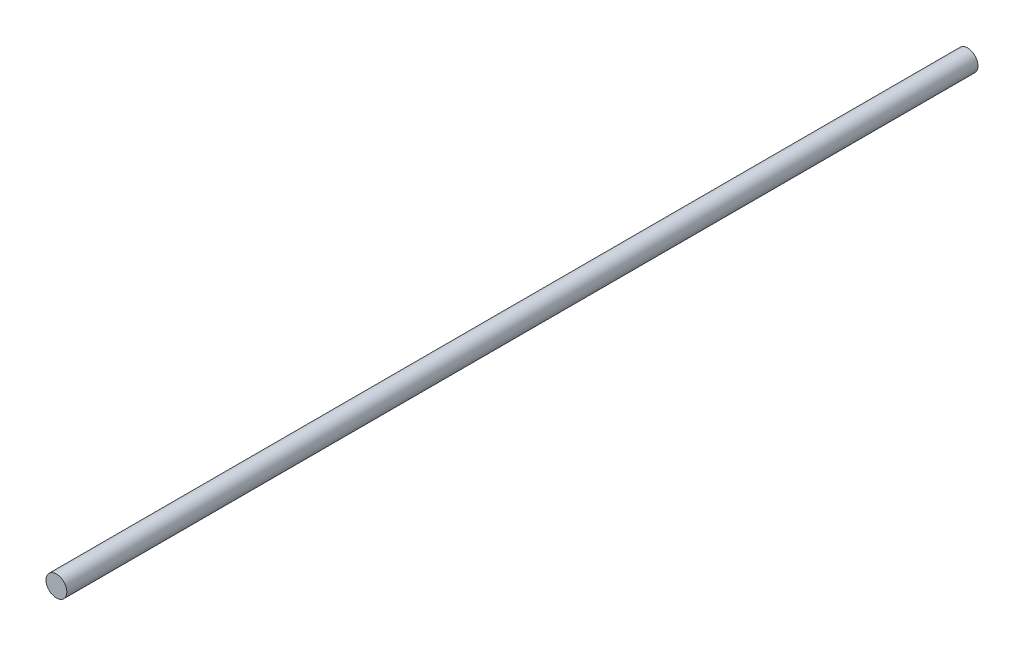
from build123d import *

# Parameters (mm, degrees)
SKETCH_1_R      = 4
EXTRUDE_1_DEPTH = 350


with BuildPart() as part:
    # 草圖1 → 填料-伸長1 (new body)
    with BuildSketch(Plane.XY):
        Circle(SKETCH_1_R)
    extrude(amount=EXTRUDE_1_DEPTH)


solid = part.part
